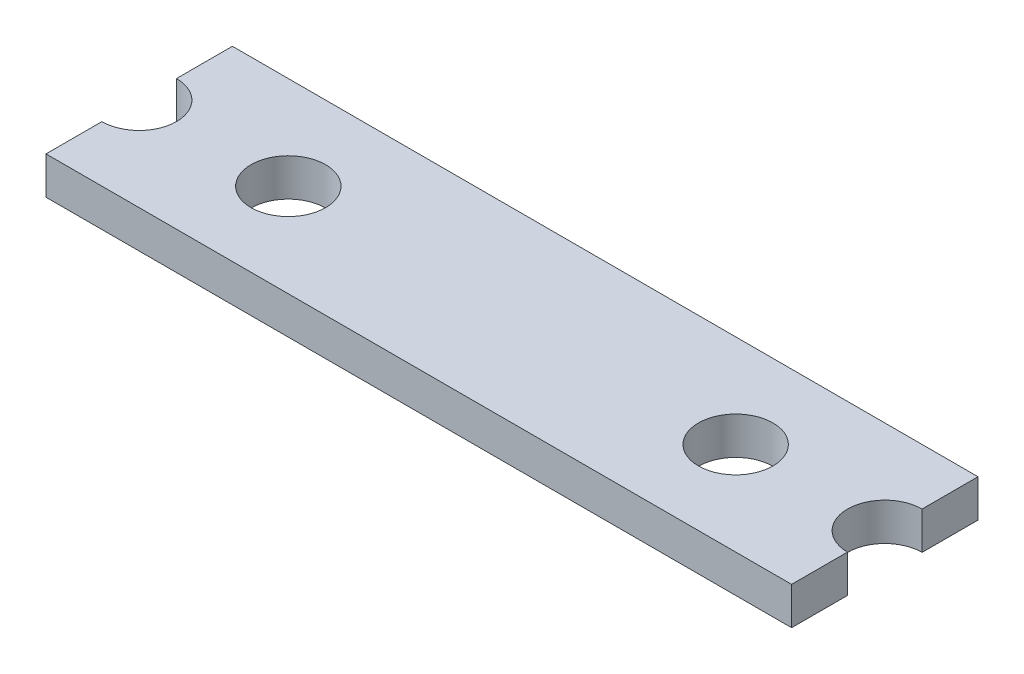
from build123d import *

# Parameters (mm, degrees)
SKETCH1_W           = 31.75
SKETCH1_H           = 7.9375
BOSS_EXTRUDE1_DEPTH = 1.6
SKETCH2_R           = 1.5875
CUT_EXTRUDE1_DEPTH  = 17.441611891


with BuildPart() as part:
    # Sketch1 → Boss-Extrude1 (new body)
    with BuildSketch(Plane(origin=(0, 0, 0), x_dir=(1, 0, 0), z_dir=(0, 1, 0))):
        Rectangle(SKETCH1_W, SKETCH1_H)
    extrude(amount=BOSS_EXTRUDE1_DEPTH)

    # Sketch2 → Cut-Extrude1 (cut, through all)
    with BuildSketch(Plane(origin=(0, 1.6, 0), x_dir=(1, 0, 0), z_dir=(0, 1, 0))):
        with Locations(Location((-9.525, 0, 0), (0, 0, 270))):
            Circle(SKETCH2_R)
        with Locations(Location((9.525, 0, 0), (0, 0, 270))):
            Circle(SKETCH2_R)
        with BuildLine():
            Line((-15.875, 1.5875), (-15.875, -1.5875))
            ThreePointArc((-15.875, -1.5875), (-14.2875, 0), (-15.875, 1.5875))
        make_face()
        with BuildLine():
            Line((15.875, -1.5875), (15.875, 1.5875))
            ThreePointArc((15.875, 1.5875), (14.2875, 0), (15.875, -1.5875))
        make_face()
    extrude(amount=-CUT_EXTRUDE1_DEPTH, mode=Mode.SUBTRACT)


solid = part.part
